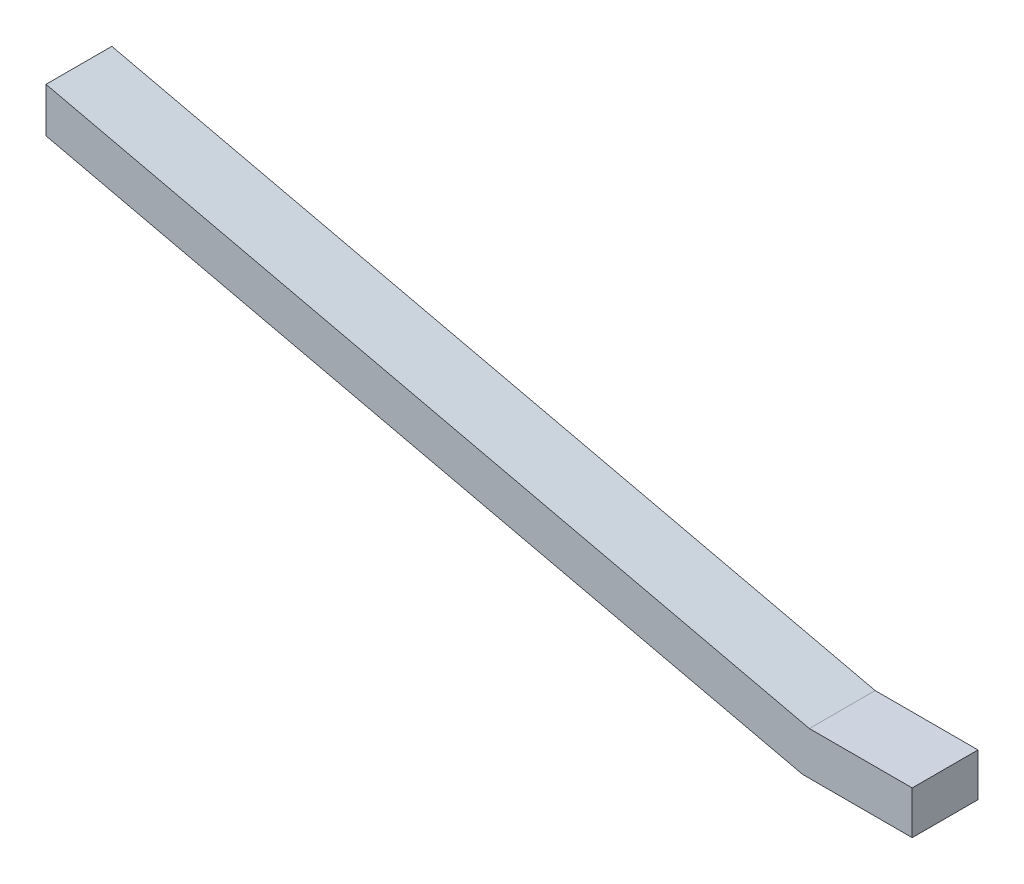
from build123d import *

# Parameters (mm, degrees)
SALIENTE_EXTRUIR1_DEPTH = 1200


with BuildPart() as part:
    # Croquis1 → Saliente-Extruir1 (new body)
    with BuildSketch(Plane.XY):
        Polygon((0, 0), (13920.996685194, -3213.915323376), (15795.866067594, -3213.915323376), (15795.866067594, -4000), (13795.866067594, -4000), (0, -814.973355964), align=None)
    extrude(amount=SALIENTE_EXTRUIR1_DEPTH)


solid = part.part
